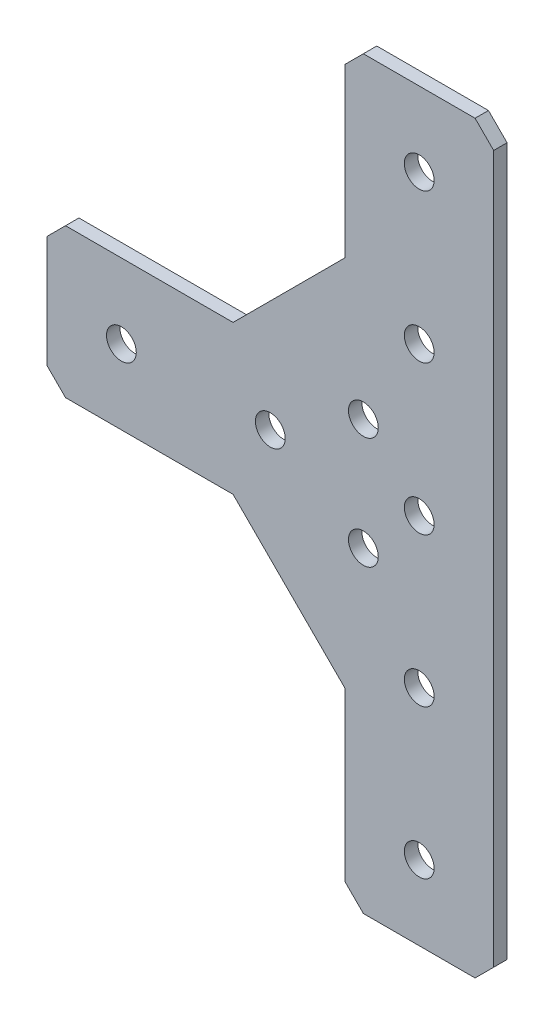
from build123d import *

# Parameters (mm, degrees)
SKETCH1_R           = 2.54
BOSS_EXTRUDE1_DEPTH = 2.286


with BuildPart() as part:
    # Sketch1 → Boss-Extrude1 (new body)
    with BuildSketch(Plane(origin=(0, 0, -2.286), x_dir=(-1, 0, 0), z_dir=(0, 0, -1))):
        Polygon((31.75, -12.7), (60.325, -12.7), (63.5, -9.525), (63.5, 9.525), (60.325, 12.7), (31.75, 12.7), (12.7, 31.75), (12.7, 60.325), (9.525, 63.5), (-9.525, 63.5), (-12.7, 60.325), (-12.7, -60.325), (-9.525, -63.5), (9.525, -63.5), (12.7, -60.325), (12.7, -31.75), align=None)
        with Locations(Location((0, -50.8, 0), (0, 0, 180))):
            Circle(SKETCH1_R, mode=Mode.SUBTRACT)
        with Locations(Location((0, -25.4, 0), (0, 0, 180))):
            Circle(SKETCH1_R, mode=Mode.SUBTRACT)
        with Locations(Location((0, 0, 0), (0, 0, 180))):
            Circle(SKETCH1_R, mode=Mode.SUBTRACT)
        with Locations(Location((0, 50.8, 0), (0, 0, 180))):
            Circle(SKETCH1_R, mode=Mode.SUBTRACT)
        with Locations(Location((0, 25.4, 0), (0, 0, 180))):
            Circle(SKETCH1_R, mode=Mode.SUBTRACT)
        with Locations(Location((50.8, 0, 0), (0, 0, 180))):
            Circle(SKETCH1_R, mode=Mode.SUBTRACT)
        with Locations(Location((25.4, 0, 0), (0, 0, 180))):
            Circle(SKETCH1_R, mode=Mode.SUBTRACT)
        with Locations(Location((9.525, -9.525, 0), (0, 0, 180))):
            Circle(SKETCH1_R, mode=Mode.SUBTRACT)
        with Locations(Location((9.525, 9.525, 0), (0, 0, 180))):
            Circle(SKETCH1_R, mode=Mode.SUBTRACT)
    extrude(amount=-BOSS_EXTRUDE1_DEPTH)


solid = part.part
